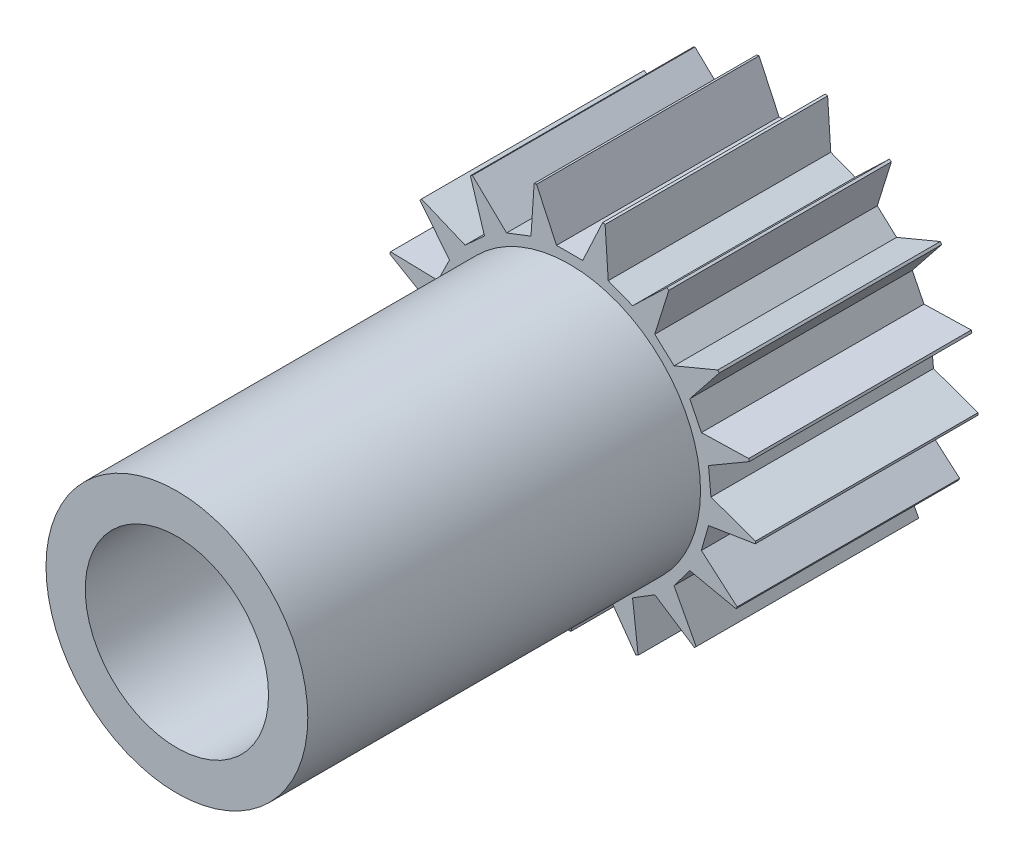
from build123d import *

# Parameters (mm, degrees)
SKETCH_1_R          = 14.25
EXTRUDE_1_DEPTH     = 17
SKETCH_2_R          = 10
EXTRUDE_2_DEPTH     = 30
CUT_EXTRUDE_1_DEPTH = 52.138292893
SKETCH_4_R          = 7
CUT_EXTRUDE_2_DEPTH = 52.123690078


with BuildPart() as part:
    # 草图1 → 拉伸1 (new body)
    with BuildSketch(Plane.XY):
        Circle(SKETCH_1_R)
    extrude(amount=EXTRUDE_1_DEPTH)

    # 草图2 → 拉伸2 (add)
    with BuildSketch(Plane.XY.offset(17)):
        Circle(SKETCH_2_R)
    extrude(amount=EXTRUDE_2_DEPTH)

    # 草图3 → 切除-拉伸1 (cut, through all)
    with BuildSketch(Plane(origin=(0, 0, 0), x_dir=(-1, 0, 0), z_dir=(0, 0, -1))):
        with BuildLine():
            Line((2.950875682, 10.385318132), (4.815820141, 9.6628348))
            Line((4.815820141, 9.6628348), (7.422273255, 12.164388999))
            ThreePointArc((7.422273255, 12.164388999), (5.147693743, 13.287729269), (2.709969755, 13.989945101))
            Line((2.709969755, 13.989945101), (2.950875682, 10.385318132))
        make_face()
        with BuildLine():
            Line((-1, 10.75), (1, 10.75))
            Line((1, 10.75), (2.526779539, 14.024189287))
            ThreePointArc((2.526779539, 14.024189287), (0, 14.25), (-2.526779539, 14.024189287))
            Line((-2.526779539, 14.024189287), (-1, 10.75))
        make_face()
        with BuildLine():
            Line((6.503219252, 8.618041504), (7.981237086, 7.270650216))
            Line((7.981237086, 7.270650216), (11.315347839, 8.661720572))
            ThreePointArc((11.315347839, 8.661720572), (9.600162922, 10.53087707), (7.580722617, 12.066281308))
            Line((7.580722617, 12.066281308), (6.503219252, 8.618041504))
        make_face()
        with BuildLine():
            Line((9.177267026, 5.686850616), (10.068743738, 3.896524033))
            Line((10.068743738, 3.896524033), (13.680221998, 3.989238785))
            ThreePointArc((13.680221998, 3.989238785), (12.756076902, 6.35177157), (11.427656884, 8.512999362))
            Line((11.427656884, 8.512999362), (9.177267026, 5.686850616))
        make_face()
        with BuildLine():
            Line((10.611874036, 1.987619041), (10.796410755, -0.003849312))
            Line((10.796410755, -0.003849312), (14.197506371, -1.222011804))
            ThreePointArc((14.197506371, -1.222011804), (14.189212012, 1.314824122), (13.731222765, 3.809989681))
            Line((13.731222765, 3.809989681), (10.611874036, 1.987619041))
        make_face()
        with BuildLine():
            Line((10.613288654, -1.9800515), (10.065962674, -3.903702786))
            Line((10.065962674, -3.903702786), (12.797338837, -6.268222929))
            ThreePointArc((12.797338837, -6.268222929), (13.706015415, -3.899697609), (14.180310925, -1.407580219))
            Line((14.180310925, -1.407580219), (10.613288654, -1.9800515))
        make_face()
        with BuildLine():
            Line((9.18131983, -5.680305114), (7.976050557, -7.276339568))
            Line((7.976050557, -7.276339568), (9.668819781, -10.467875813))
            ThreePointArc((9.668819781, -10.467875813), (11.371745489, -8.587543568), (12.714269518, -6.43504861))
            Line((12.714269518, -6.43504861), (9.18131983, -5.680305114))
        make_face()
        with BuildLine():
            Line((6.509362887, -8.613402046), (4.808928615, -9.666266372))
            Line((4.808928615, -9.666266372), (5.234473037, -13.253784064))
            ThreePointArc((5.234473037, -13.253784064), (7.501658321, -12.115594184), (9.531095561, -10.593428029))
            Line((9.531095561, -10.593428029), (6.509362887, -8.613402046))
        make_face()
        with BuildLine():
            Line((2.958280416, -10.383211304), (0.992334217, -10.750710339))
            Line((0.992334217, -10.750710339), (0.093181704, -14.249695336))
            ThreePointArc((0.093181704, -14.249695336), (2.618430629, -14.00736667), (5.060694335, -13.321106292))
            Line((5.060694335, -13.321106292), (2.958280416, -10.383211304))
        make_face()
        with BuildLine():
            Line((-0.992334217, -10.750710339), (-2.958280416, -10.383211304))
            Line((-2.958280416, -10.383211304), (-5.060694335, -13.321106292))
            ThreePointArc((-5.060694335, -13.321106292), (-2.618430629, -14.00736667), (-0.093181704, -14.249695336))
            Line((-0.093181704, -14.249695336), (-0.992334217, -10.750710339))
        make_face()
        with BuildLine():
            Line((-4.808928615, -9.666266372), (-6.509362887, -8.613402046))
            Line((-6.509362887, -8.613402046), (-9.531095561, -10.593428029))
            ThreePointArc((-9.531095561, -10.593428029), (-7.501658321, -12.115594184), (-5.234473037, -13.253784064))
            Line((-5.234473037, -13.253784064), (-4.808928615, -9.666266372))
        make_face()
        with BuildLine():
            Line((-7.976050557, -7.276339568), (-9.18131983, -5.680305114))
            Line((-9.18131983, -5.680305114), (-12.714269518, -6.43504861))
            ThreePointArc((-12.714269518, -6.43504861), (-11.371745489, -8.587543568), (-9.668819781, -10.467875813))
            Line((-9.668819781, -10.467875813), (-7.976050557, -7.276339568))
        make_face()
        with BuildLine():
            Line((-10.065962674, -3.903702786), (-10.613288654, -1.9800515))
            Line((-10.613288654, -1.9800515), (-14.180310925, -1.407580219))
            ThreePointArc((-14.180310925, -1.407580219), (-13.706015415, -3.899697609), (-12.797338837, -6.268222929))
            Line((-12.797338837, -6.268222929), (-10.065962674, -3.903702786))
        make_face()
        with BuildLine():
            Line((-10.796410755, -0.003849312), (-10.611874036, 1.987619041))
            Line((-10.611874036, 1.987619041), (-13.731222765, 3.809989681))
            ThreePointArc((-13.731222765, 3.809989681), (-14.189212012, 1.314824122), (-14.197506371, -1.222011804))
            Line((-14.197506371, -1.222011804), (-10.796410755, -0.003849312))
        make_face()
        with BuildLine():
            Line((-10.068743738, 3.896524033), (-9.177267026, 5.686850616))
            Line((-9.177267026, 5.686850616), (-11.427656884, 8.512999362))
            ThreePointArc((-11.427656884, 8.512999362), (-12.756076902, 6.35177157), (-13.680221998, 3.989238785))
            Line((-13.680221998, 3.989238785), (-10.068743738, 3.896524033))
        make_face()
        with BuildLine():
            Line((-7.981237086, 7.270650216), (-6.503219252, 8.618041504))
            Line((-6.503219252, 8.618041504), (-7.580722617, 12.066281308))
            ThreePointArc((-7.580722617, 12.066281308), (-9.600162922, 10.53087707), (-11.315347839, 8.661720572))
            Line((-11.315347839, 8.661720572), (-7.981237086, 7.270650216))
        make_face()
        with BuildLine():
            Line((-4.815820141, 9.6628348), (-2.950875682, 10.385318132))
            Line((-2.950875682, 10.385318132), (-2.709969755, 13.989945101))
            ThreePointArc((-2.709969755, 13.989945101), (-5.147693743, 13.287729269), (-7.422273255, 12.164388999))
            Line((-7.422273255, 12.164388999), (-4.815820141, 9.6628348))
        make_face()
    extrude(amount=-CUT_EXTRUDE_1_DEPTH, mode=Mode.SUBTRACT)

    # 草图4 → 切除-拉伸2 (cut, through all)
    with BuildSketch(Plane.XY.offset(47)):
        Circle(SKETCH_4_R)
    extrude(amount=-CUT_EXTRUDE_2_DEPTH, mode=Mode.SUBTRACT)


solid = part.part
